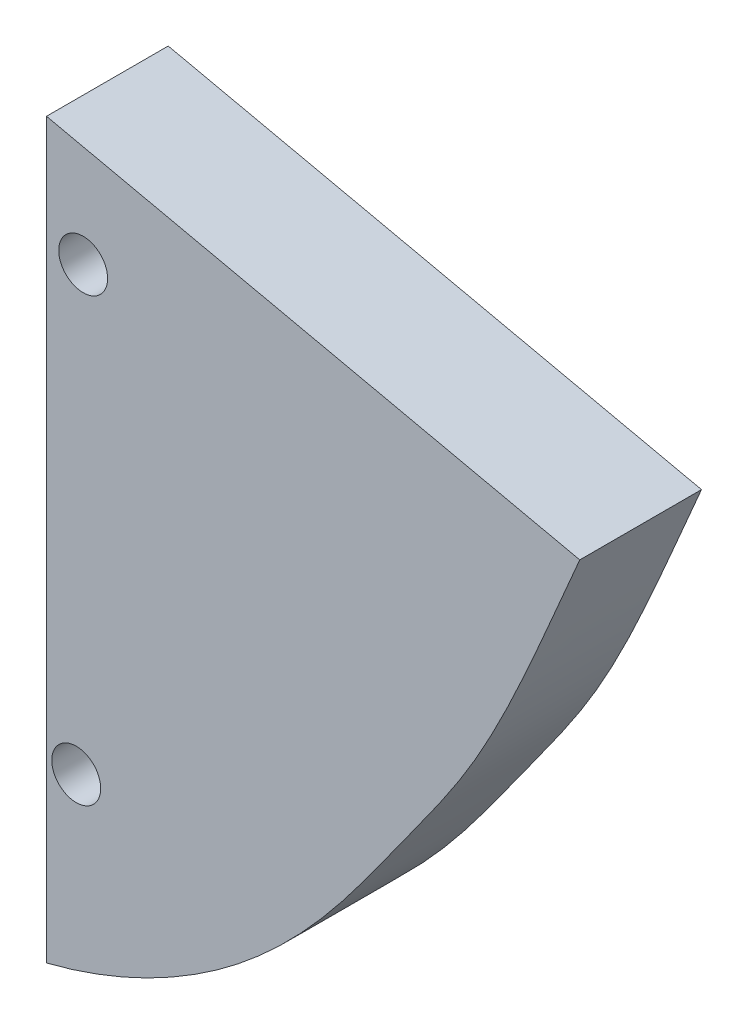
from build123d import *

# Parameters (mm, degrees)
SALIENTE_EXTRUIR1_DEPTH = 4.98
CROQUIS2_R              = 1
CORTAR_EXTRUIR1_DEPTH   = 5
CORTAR_EXTRUIR3_REACH   = 36.304
CROQUIS4_R              = 1


with BuildPart() as part:
    # Croquis1 → Saliente-Extruir1 (new body)
    with BuildSketch(Plane.XY):
        with BuildLine():
            Line((0, -4), (0, 26))
            Line((0, 26), (21.816861247, 21.191410261))
            add(Edge.make_bspline(
                [(0, -4), (2.906764931, -3.267903802), (7.189424572, -1.091865696), (11.643736623, 3.460788761), (14.473771474, 7.480841145), (17.337780125, 11.369260365), (19.648075945, 16.032903585), (21.017709919, 19.355582105), (21.816861247, 21.191410261)],
                knots=[0, 0, 0, 0, 0.260017683, 0.40718949, 0.54930604, 0.687276252, 0.826057346, 1, 1, 1, 1], degree=3))
        make_face()
    extrude(amount=SALIENTE_EXTRUIR1_DEPTH)

    # Croquis2 → Cortar-Extruir1 (cut)
    with BuildSketch(Plane.XY.offset(4.98)):
        with Locations((1.5, 21.5)):
            Circle(CROQUIS2_R)
    extrude(amount=-CORTAR_EXTRUIR1_DEPTH, mode=Mode.SUBTRACT)

    # Croquis4 → Cortar-Extruir3 (cut, up to next)
    with BuildSketch(Plane.XY.offset(4.98), mode=Mode.PRIVATE) as cortar_extruir3_sk1:
        with Locations((1.216735104, 3.291060379)):
            Circle(CROQUIS4_R)
    cortar_extruir3_tool1 = extrude(cortar_extruir3_sk1.sketch, amount=-CORTAR_EXTRUIR3_REACH, mode=Mode.PRIVATE) & part.part
    add(cortar_extruir3_tool1.solids().sort_by_distance((1.216735, 3.29106, 4.98))[0], mode=Mode.SUBTRACT)


solid = part.part
